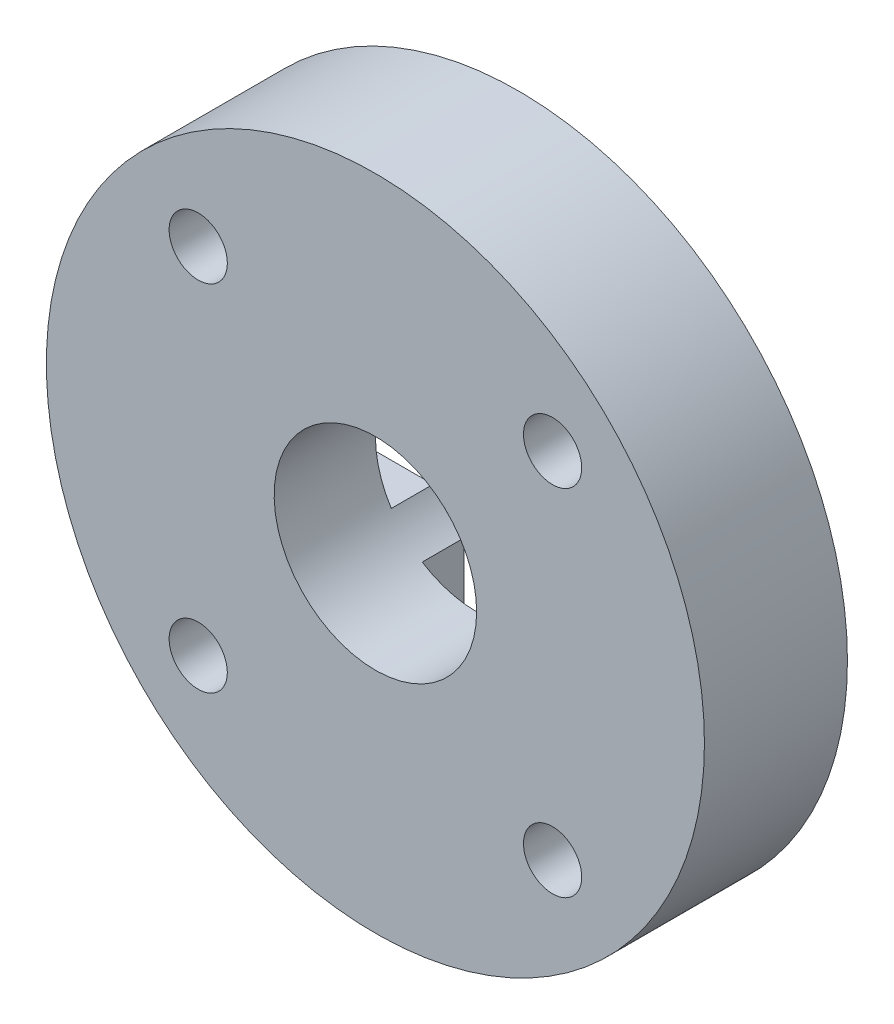
from build123d import *

# Parameters (mm, degrees)
TRIAL_LOAD_PLATE_PROFILE_R           = 13
TRIAL_LOAD_PLATE_PROFILE_R_2         = 4
TRIAL_LOAD_PLATE_DEPTH               = 4
CAPTURED_HORN_KEY_BOSS_START         = -1.65
CAPTURED_HORN_KEY_BOSS_PROFILE_R     = 13
CAPTURED_HORN_KEY_BOSS_DEPTH         = 1.65
KEY_POCKET_HUB_START                 = -1.65
STOCK_HORN_POCKET_HUB_R              = 3.6
KEY_POCKET_HUB_DEPTH                 = 1.65
KEY_POCKET_HORIZONTAL_START          = -1.65
STOCK_HORN_POCKET_HORIZONTAL_W       = 16.3
STOCK_HORN_POCKET_HORIZONTAL_H       = 4.3
KEY_POCKET_HORIZONTAL_DEPTH          = 1.65
KEY_POCKET_VERTICAL_START            = -1.65
STOCK_HORN_POCKET_VERTICAL_W         = 4.3
STOCK_HORN_POCKET_VERTICAL_H         = 16.3
KEY_POCKET_VERTICAL_DEPTH            = 1.65
KEY_POCKET_ROUNDED_TIPS_START        = -1.65
STOCK_HORN_POCKET_ROUNDED_TIPS_R     = 2.15
KEY_POCKET_ROUNDED_TIPS_DEPTH        = 1.65
UNMODIFIED_HORN_CAPTURE_M2_START     = -50
UNMODIFIED_HORN_CAPTURE_M2_PROFILE_R = 1.15
UNMODIFIED_HORN_CAPTURE_M2_DEPTH     = 69.814887722
HUB_CLEARANCE_IN_KEY_BOSS_ONLY_START = -1.65
HORN_CENTER_HUB_CLEARANCE_R          = 4
HUB_CLEARANCE_IN_KEY_BOSS_ONLY_DEPTH = 1.65


with BuildPart() as part:
    # Trial_load_plate_profile → Trial_load_plate (new body)
    with BuildSketch(Plane.XY):
        Circle(TRIAL_LOAD_PLATE_PROFILE_R)
        Circle(TRIAL_LOAD_PLATE_PROFILE_R_2, mode=Mode.SUBTRACT)
    extrude(amount=TRIAL_LOAD_PLATE_DEPTH)

    # Captured_horn_key_boss_profile → Captured_horn_key_boss (add)
    with BuildSketch(Plane.XY.offset(CAPTURED_HORN_KEY_BOSS_START)):
        Circle(CAPTURED_HORN_KEY_BOSS_PROFILE_R)
    extrude(amount=CAPTURED_HORN_KEY_BOSS_DEPTH)

    # Stock_horn_pocket_Hub → Key_pocket_Hub (cut)
    with BuildSketch(Plane.XY.offset(KEY_POCKET_HUB_START)):
        Circle(STOCK_HORN_POCKET_HUB_R)
    extrude(amount=KEY_POCKET_HUB_DEPTH, mode=Mode.SUBTRACT)

    # Stock_horn_pocket_Horizontal → Key_pocket_Horizontal (cut)
    with BuildSketch(Plane.XY.offset(KEY_POCKET_HORIZONTAL_START)):
        Rectangle(STOCK_HORN_POCKET_HORIZONTAL_W, STOCK_HORN_POCKET_HORIZONTAL_H)
    extrude(amount=KEY_POCKET_HORIZONTAL_DEPTH, mode=Mode.SUBTRACT)

    # Stock_horn_pocket_Vertical → Key_pocket_Vertical (cut)
    with BuildSketch(Plane.XY.offset(KEY_POCKET_VERTICAL_START)):
        Rectangle(STOCK_HORN_POCKET_VERTICAL_W, STOCK_HORN_POCKET_VERTICAL_H)
    extrude(amount=KEY_POCKET_VERTICAL_DEPTH, mode=Mode.SUBTRACT)

    # Stock_horn_pocket_Rounded_tips → Key_pocket_Rounded_tips (cut)
    with BuildSketch(Plane.XY.offset(KEY_POCKET_ROUNDED_TIPS_START)):
        with Locations((8.15, 0)):
            Circle(STOCK_HORN_POCKET_ROUNDED_TIPS_R)
        with Locations((-8.15, 0)):
            Circle(STOCK_HORN_POCKET_ROUNDED_TIPS_R)
        with Locations((0, 8.15)):
            Circle(STOCK_HORN_POCKET_ROUNDED_TIPS_R)
        with Locations((0, -8.15)):
            Circle(STOCK_HORN_POCKET_ROUNDED_TIPS_R)
    extrude(amount=KEY_POCKET_ROUNDED_TIPS_DEPTH, mode=Mode.SUBTRACT)

    # Unmodified_horn_capture_M2_profile → Unmodified_horn_capture_M2 (cut, through all)
    with BuildSketch(Plane.XY.offset(UNMODIFIED_HORN_CAPTURE_M2_START)):
        with Locations((7, 7)):
            Circle(UNMODIFIED_HORN_CAPTURE_M2_PROFILE_R)
        with Locations((-7, 7)):
            Circle(UNMODIFIED_HORN_CAPTURE_M2_PROFILE_R)
        with Locations((-7, -7)):
            Circle(UNMODIFIED_HORN_CAPTURE_M2_PROFILE_R)
        with Locations((7, -7)):
            Circle(UNMODIFIED_HORN_CAPTURE_M2_PROFILE_R)
    extrude(amount=UNMODIFIED_HORN_CAPTURE_M2_DEPTH, mode=Mode.SUBTRACT)

    # Horn_center_hub_clearance → Hub_clearance_in_key_boss_only (cut)
    with BuildSketch(Plane.XY.offset(HUB_CLEARANCE_IN_KEY_BOSS_ONLY_START)):
        with Locations(Location((0, 0, 0), (0, 0, 147.486385367))):
            Circle(HORN_CENTER_HUB_CLEARANCE_R)
    extrude(amount=HUB_CLEARANCE_IN_KEY_BOSS_ONLY_DEPTH, mode=Mode.SUBTRACT)


solid = part.part
